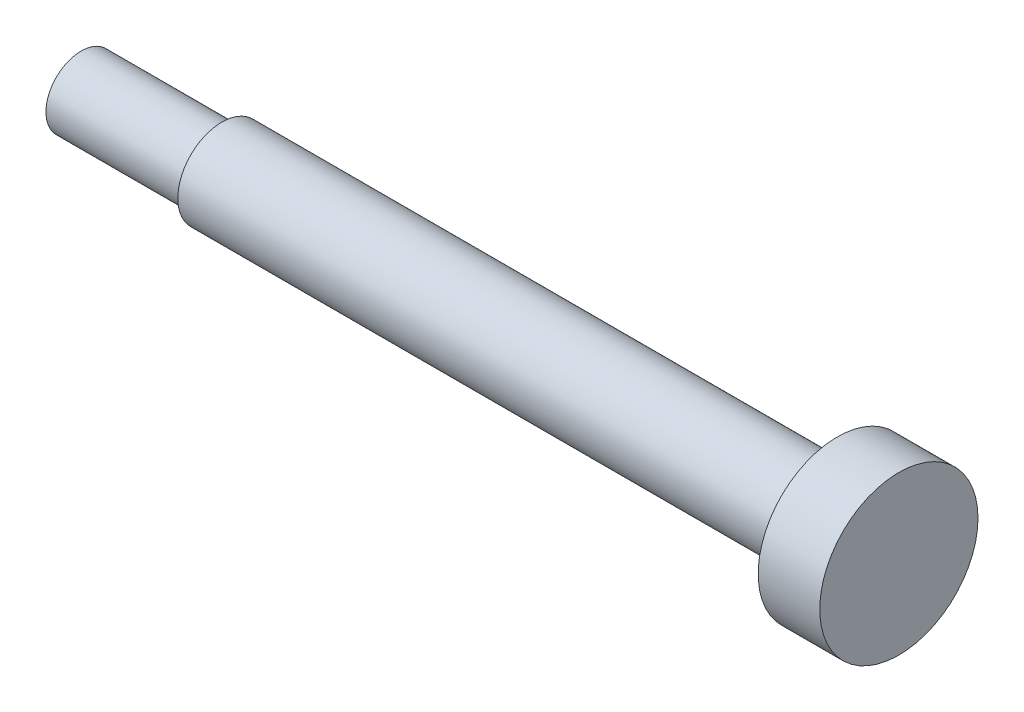
from build123d import *


with BuildPart() as part:
    # Sketch1 → Revolve1 (revolve)
    with BuildSketch(Plane.XY, mode=Mode.PRIVATE) as revolve1_sk:
        Polygon((3.5, 0), (3.5, 4.5), (0, 4.5), (0, 2.5), (-35, 2.5), (-35, 2), (-43, 2), (-43, 0), align=None)
    revolve(revolve1_sk.sketch.rotate(Axis((0, 0, 0), (-1, 0, 0)), 90), axis=Axis((0, 0, 0), (-1, 0, 0)))


solid = part.part
